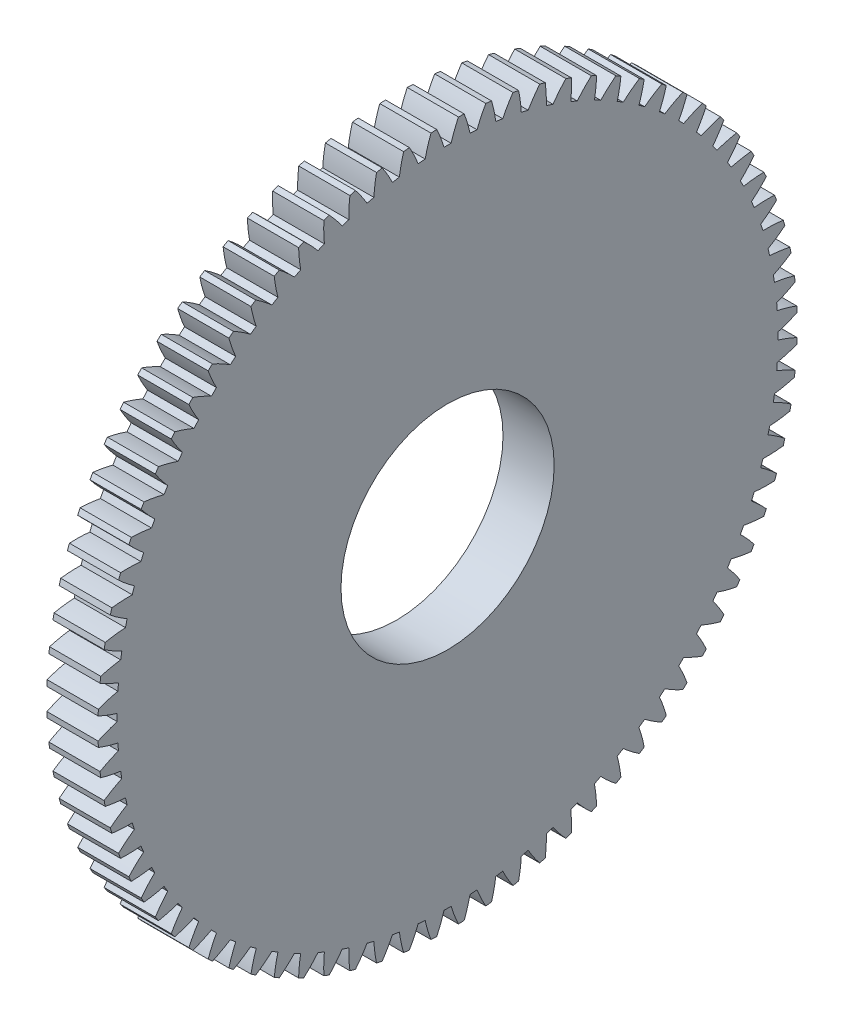
from build123d import *

# Parameters (mm, degrees)
BASPROSKE_W     = 12
BASPROSKE_H     = 82
TOOTHCUT_DEPTH  = 117.584733134
TEETHCUTS_COUNT = 80
TEETHCUTS_ANGLE = 355.5
BORSKE_R        = 25
BORE_DEPTH      = 50.0000508


with BuildPart() as part:
    # BasProSke → Base-Revolve (revolve)
    with BuildSketch(Plane(origin=(0, 0, 0), x_dir=(1, 0, 0), z_dir=(0, 1, 0)), mode=Mode.PRIVATE) as base_revolve_sk:
        with Locations((6, 41)):
            Rectangle(BASPROSKE_W, BASPROSKE_H)
    revolve(base_revolve_sk.sketch.rotate(Axis((-10, 0, 0), (1, 0, 0)), 180), axis=Axis((-10, 0, 0), (1, 0, 0)))

    # TooCutSke → ToothCut (cut, through all)
    with BuildSketch(Plane(origin=(0, 0, 0), x_dir=(0, 0, -1), z_dir=(1, 0, 0))):
        with BuildLine():
            ThreePointArc((0.826151948, 77.494596418), (0, 77.499), (-0.826151948, 77.494596418))
            ThreePointArc((-0.826151948, 77.494596418), (-1.606395028, 79.772645896), (-2.555728345, 81.985574937))
            ThreePointArc((-2.555728345, 81.985574937), (0, 82.0254), (2.555728345, 81.985574937))
            ThreePointArc((2.555728345, 81.985574937), (1.606395028, 79.772645896), (0.826151948, 77.494596418))
        make_face()
    toothcut = extrude(amount=TOOTHCUT_DEPTH, mode=Mode.SUBTRACT)

    # TeethCuts: ToothCut ×80 about axis
    teethcuts_axis = Axis((-10, 0, 0), (1, 0, 0))
    for i in range(1, TEETHCUTS_COUNT):
        add(toothcut.rotate(teethcuts_axis, i * TEETHCUTS_ANGLE / (TEETHCUTS_COUNT - 1)), mode=Mode.SUBTRACT)

    # BorSke → Bore (cut, symmetric)
    with BuildSketch(Plane(origin=(0, 0, 0), x_dir=(0, 0, -1), z_dir=(1, 0, 0))):
        with Locations(Location((0, 0, 0), (0, 0, 180))):
            Circle(BORSKE_R)
    extrude(amount=BORE_DEPTH, both=True, mode=Mode.SUBTRACT)


solid = part.part
